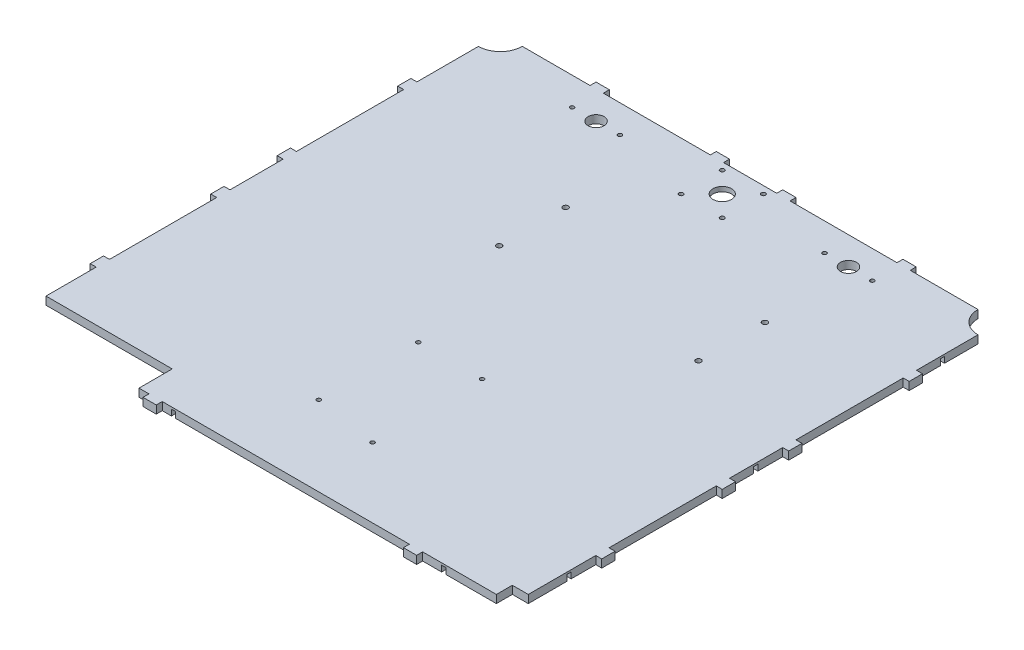
from build123d import *

# Parameters (mm, degrees)
SALIENTE_EXTRUIR1_DEPTH = 6
CORTAR_EXTRUIR1_DEPTH   = 4.5
CROQUIS5_R              = 7
CROQUIS5_R_2            = 1.6
CROQUIS5_R_3            = 6
CROQUIS5_R_4            = 1.5
CROQUIS5_W              = 12
CROQUIS5_H              = 12
CORTAR_EXTRUIR2_DEPTH   = 6
CROQUIS7_R              = 2
CROQUIS7_R_2            = 1.5
CROQUIS7_W              = 95
CROQUIS7_H              = 25
CORTAR_EXTRUIR4_DEPTH   = 10
CORTAR_EXTRUIR5_START   = -2.5
CROQUIS8_R              = 11
CROQUIS8_R_2            = 7
CROQUIS8_R_3            = 4.5
CROQUIS8_R_4            = 1.5
CORTAR_EXTRUIR5_DEPTH   = 2.5


with BuildPart() as part:
    # Croquis1 → Saliente-Extruir1 (new body)
    with BuildSketch(Plane(origin=(0, 0, 0), x_dir=(1, 0, 0), z_dir=(0, 1, 0))):
        with BuildLine():
            Line((0, 0), (67.5, 0))
            Line((67.5, 0), (77.5, 0))
            Line((77.5, 0), (102.5, 0))
            Line((102.5, 0), (102.5, -4.5))
            Line((102.5, -4.5), (112.5, -4.5))
            Line((112.5, -4.5), (112.5, 0))
            Line((112.5, 0), (298.5, 0))
            Line((298.5, 0), (298.5, -4.5))
            Line((298.5, -4.5), (308.5, -4.5))
            Line((308.5, -4.5), (308.5, 0))
            Line((308.5, 0), (376, 0))
            Line((376, 0), (376, 62.8))
            Line((376, 62.8), (380.5, 62.8))
            Line((380.5, 62.8), (380.5, 72.8))
            Line((380.5, 72.8), (376, 72.8))
            Line((376, 72.8), (376, 153.5))
            Line((376, 153.5), (380.5, 153.5))
            Line((380.5, 153.5), (380.5, 163.5))
            Line((380.5, 163.5), (376, 163.5))
            Line((376, 163.5), (376, 203.5))
            Line((376, 203.5), (380.5, 203.5))
            Line((380.5, 203.5), (380.5, 213.5))
            Line((380.5, 213.5), (376, 213.5))
            Line((376, 213.5), (376, 294.2))
            Line((376, 294.2), (380.5, 294.2))
            Line((380.5, 294.2), (380.5, 304.2))
            Line((380.5, 304.2), (376, 304.2))
            Line((376, 304.2), (376, 350.5))
            ThreePointArc((376, 350.5), (364.33273811, 355.33273811), (359.5, 367))
            Line((359.5, 367), (308.5, 367))
            Line((308.5, 367), (308.5, 371.5))
            Line((308.5, 371.5), (298.5, 371.5))
            Line((298.5, 371.5), (298.5, 367))
            Line((298.5, 367), (218, 367))
            Line((218, 367), (218, 371.5))
            Line((218, 371.5), (208, 371.5))
            Line((208, 371.5), (208, 367))
            Line((208, 367), (168, 367))
            Line((168, 367), (168, 371.5))
            Line((168, 371.5), (158, 371.5))
            Line((158, 371.5), (158, 367))
            Line((158, 367), (77.5, 367))
            Line((77.5, 367), (77.5, 371.5))
            Line((77.5, 371.5), (67.5, 371.5))
            Line((67.5, 371.5), (67.5, 367))
            Line((67.5, 367), (16.5, 367))
            ThreePointArc((16.5, 367), (11.66726189, 355.33273811), (0, 350.5))
            Line((0, 350.5), (0, 304.2))
            Line((0, 304.2), (-4.5, 304.2))
            Line((-4.5, 304.2), (-4.5, 294.2))
            Line((-4.5, 294.2), (0, 294.2))
            Line((0, 294.2), (0, 213.5))
            Line((0, 213.5), (-4.5, 213.5))
            Line((-4.5, 213.5), (-4.5, 203.5))
            Line((-4.5, 203.5), (0, 203.5))
            Line((0, 203.5), (0, 163.5))
            Line((0, 163.5), (-4.5, 163.5))
            Line((-4.5, 163.5), (-4.5, 153.5))
            Line((-4.5, 153.5), (0, 153.5))
            Line((0, 153.5), (0, 72.8))
            Line((0, 72.8), (-4.5, 72.8))
            Line((-4.5, 72.8), (-4.5, 62.8))
            Line((-4.5, 62.8), (0, 62.8))
            Line((0, 62.8), (0, 0))
        make_face()
    extrude(amount=-SALIENTE_EXTRUIR1_DEPTH)

    # Croquis3 → Cortar-Extruir1 (cut)
    with BuildSketch(Plane.XZ.offset(6)):
        with BuildLine():
            Line((325.901879925, -6.500225242), (325.901879925, 0))
            Line((325.901879925, 0), (322.801879925, 0))
            Line((322.801879925, 0), (322.801879925, -6.500225243))
            ThreePointArc((322.801879925, -6.500225243), (321.87727529, -7.028314779), (321.511542294, -8.028320611))
            Line((321.511542294, -8.028320611), (321.511542294, -9.578320611))
            ThreePointArc((321.511542294, -9.578320611), (321.700239124, -10.319504582), (322.220385751, -10.880225243))
            Line((322.220385751, -10.880225243), (322.389630684, -10.880225243))
            ThreePointArc((322.389630684, -10.880225243), (324.351879925, -11.693235227), (326.314129166, -10.880225242))
            Line((326.314129166, -10.880225242), (326.483374099, -10.880225243))
            ThreePointArc((326.483374099, -10.880225243), (327.003520726, -10.319504582), (327.192217556, -9.578320611))
            Line((327.192217556, -9.578320611), (327.192217556, -8.028320611))
            ThreePointArc((327.192217556, -8.028320611), (326.82648456, -7.028314779), (325.901879925, -6.500225242))
        make_face()
        with BuildLine():
            Line((322.801879925, -360.499774758), (322.801879925, -367))
            Line((322.801879925, -367), (325.901879925, -367))
            Line((325.901879925, -367), (325.901879925, -360.499774758))
            ThreePointArc((325.901879925, -360.499774758), (326.82648456, -359.971685221), (327.192217556, -358.971679389))
            Line((327.192217556, -358.971679389), (327.192217556, -357.421679389))
            ThreePointArc((327.192217556, -357.421679389), (327.003520726, -356.680495418), (326.483374099, -356.119774758))
            Line((326.483374099, -356.119774758), (326.314129166, -356.119774758))
            ThreePointArc((326.314129166, -356.119774758), (324.351879925, -355.306764773), (322.389630684, -356.119774757))
            Line((322.389630684, -356.119774757), (322.220385751, -356.119774757))
            ThreePointArc((322.220385751, -356.119774757), (321.700239124, -356.680495418), (321.511542294, -357.421679389))
            Line((321.511542294, -357.421679389), (321.511542294, -358.971679389))
            ThreePointArc((321.511542294, -358.971679389), (321.87727529, -359.971685221), (322.801879925, -360.499774758))
        make_face()
        with BuildLine():
            Line((8.028320611, -326.749605009), (9.578320611, -326.749605009))
            ThreePointArc((9.578320611, -326.749605009), (10.319504582, -326.560908179), (10.880225243, -326.040761552))
            Line((10.880225243, -326.040761552), (10.880225243, -325.87151662))
            ThreePointArc((10.880225243, -325.87151662), (11.693235227, -323.909267378), (10.880225243, -321.947018137))
            Line((10.880225243, -321.947018137), (10.880225243, -321.777773205))
            ThreePointArc((10.880225243, -321.777773205), (10.319504582, -321.257626577), (9.578320611, -321.068929747))
            Line((9.578320611, -321.068929747), (8.028320611, -321.068929747))
            ThreePointArc((8.028320611, -321.068929747), (7.028314779, -321.434662744), (6.500225243, -322.359267378))
            Line((6.500225243, -322.359267378), (0, -322.359267378))
            Line((0, -322.359267378), (0, -325.459267378))
            Line((0, -325.459267378), (6.500225243, -325.459267378))
            ThreePointArc((6.500225243, -325.459267378), (7.028314779, -326.383872013), (8.028320611, -326.749605009))
        make_face()
        with BuildLine():
            Line((6.500225242, -41.36), (0, -41.36))
            Line((0, -41.36), (0, -44.46))
            Line((0, -44.46), (6.500225243, -44.46))
            ThreePointArc((6.500225243, -44.46), (7.028314779, -45.384604635), (8.028320611, -45.750337631))
            Line((8.028320611, -45.750337631), (9.578320611, -45.750337631))
            ThreePointArc((9.578320611, -45.750337631), (10.319504582, -45.561640801), (10.880225243, -45.041494174))
            Line((10.880225243, -45.041494174), (10.880225243, -44.872249241))
            ThreePointArc((10.880225243, -44.872249241), (11.693235227, -42.91), (10.880225243, -40.947750759))
            Line((10.880225243, -40.947750759), (10.880225243, -40.778505826))
            ThreePointArc((10.880225243, -40.778505826), (10.319504582, -40.258359199), (9.578320611, -40.069662369))
            Line((9.578320611, -40.069662369), (8.028320611, -40.069662369))
            ThreePointArc((8.028320611, -40.069662369), (7.028314779, -40.435395365), (6.500225242, -41.36))
        make_face()
        with BuildLine():
            Line((8.028320611, -186.245954203), (9.578320611, -186.245954203))
            ThreePointArc((9.578320611, -186.245954203), (10.319504582, -186.057257373), (10.880225243, -185.537110746))
            Line((10.880225243, -185.537110746), (10.880225243, -185.367865814))
            ThreePointArc((10.880225243, -185.367865814), (11.693235227, -183.405616572), (10.880225243, -181.443367331))
            Line((10.880225243, -181.443367331), (10.880225243, -181.274122399))
            ThreePointArc((10.880225243, -181.274122399), (10.319504582, -180.753975771), (9.578320611, -180.565278941))
            Line((9.578320611, -180.565278941), (8.028320611, -180.565278941))
            ThreePointArc((8.028320611, -180.565278941), (7.028314779, -180.931011938), (6.500225243, -181.855616572))
            Line((6.500225243, -181.855616572), (0, -181.855616572))
            Line((0, -181.855616572), (0, -184.955616572))
            Line((0, -184.955616572), (6.500225243, -184.955616572))
            ThreePointArc((6.500225243, -184.955616572), (7.028314779, -185.880221207), (8.028320611, -186.245954203))
        make_face()
        with BuildLine():
            Line((122.550656557, -6.500225243), (122.550656557, 0))
            Line((122.550656557, 0), (119.450656557, 0))
            Line((119.450656557, 0), (119.450656557, -6.500225243))
            ThreePointArc((119.450656557, -6.500225243), (118.526051922, -7.028314779), (118.160318926, -8.028320611))
            Line((118.160318926, -8.028320611), (118.160318926, -9.578320611))
            ThreePointArc((118.160318926, -9.578320611), (118.349015756, -10.319504582), (118.869162383, -10.880225243))
            Line((118.869162383, -10.880225243), (119.038407316, -10.880225243))
            ThreePointArc((119.038407316, -10.880225243), (121.000656557, -11.693235227), (122.962905798, -10.880225243))
            Line((122.962905798, -10.880225243), (123.132150731, -10.880225243))
            ThreePointArc((123.132150731, -10.880225243), (123.652297358, -10.319504582), (123.840994188, -9.578320611))
            Line((123.840994188, -9.578320611), (123.840994188, -8.028320611))
            ThreePointArc((123.840994188, -8.028320611), (123.475261191, -7.028314779), (122.550656557, -6.500225243))
        make_face()
        with BuildLine():
            Line((369.499774757, -44.286426511), (376, -44.286426511))
            Line((376, -44.286426511), (376, -41.186426511))
            Line((376, -41.186426511), (369.499774757, -41.186426511))
            ThreePointArc((369.499774757, -41.186426511), (368.971685221, -40.261821877), (367.971679389, -39.89608888))
            Line((367.971679389, -39.89608888), (366.421679389, -39.89608888))
            ThreePointArc((366.421679389, -39.89608888), (365.680495418, -40.08478571), (365.119774757, -40.604932337))
            Line((365.119774757, -40.604932337), (365.119774757, -40.77417727))
            ThreePointArc((365.119774757, -40.77417727), (364.306764773, -42.736426511), (365.119774757, -44.698675752))
            Line((365.119774757, -44.698675752), (365.119774757, -44.867920685))
            ThreePointArc((365.119774757, -44.867920685), (365.680495418, -45.388067312), (366.421679389, -45.576764142))
            Line((366.421679389, -45.576764142), (367.971679389, -45.576764142))
            ThreePointArc((367.971679389, -45.576764142), (368.971685221, -45.211031146), (369.499774757, -44.286426511))
        make_face()
        with BuildLine():
            Line((367.971679389, -180.400754709), (366.421679389, -180.400754709))
            ThreePointArc((366.421679389, -180.400754709), (365.680495418, -180.589451539), (365.119774757, -181.109598166))
            Line((365.119774757, -181.109598166), (365.119774757, -181.278843099))
            ThreePointArc((365.119774757, -181.278843099), (364.306764773, -183.24109234), (365.119774757, -185.203341581))
            Line((365.119774757, -185.203341581), (365.119774757, -185.372586514))
            ThreePointArc((365.119774757, -185.372586514), (365.680495418, -185.892733141), (366.421679389, -186.081429971))
            Line((366.421679389, -186.081429971), (367.971679389, -186.081429971))
            ThreePointArc((367.971679389, -186.081429971), (368.971685221, -185.715696975), (369.499774757, -184.79109234))
            Line((369.499774757, -184.79109234), (376, -184.79109234))
            Line((376, -184.79109234), (376, -181.69109234))
            Line((376, -181.69109234), (369.499774757, -181.69109234))
            ThreePointArc((369.499774757, -181.69109234), (368.971685221, -180.766487705), (367.971679389, -180.400754709))
        make_face()
        with BuildLine():
            Line((369.499774757, -325.277950066), (376, -325.277950066))
            Line((376, -325.277950066), (376, -322.177950066))
            Line((376, -322.177950066), (369.499774757, -322.177950066))
            ThreePointArc((369.499774757, -322.177950066), (368.971685221, -321.253345432), (367.971679389, -320.887612435))
            Line((367.971679389, -320.887612435), (366.421679389, -320.887612435))
            ThreePointArc((366.421679389, -320.887612435), (365.680495418, -321.076309265), (365.119774757, -321.596455893))
            Line((365.119774757, -321.596455893), (365.119774757, -321.765700825))
            ThreePointArc((365.119774757, -321.765700825), (364.306764773, -323.727950066), (365.119774757, -325.690199308))
            Line((365.119774757, -325.690199308), (365.119774757, -325.85944424))
            ThreePointArc((365.119774757, -325.85944424), (365.680495418, -326.379590867), (366.421679389, -326.568287697))
            Line((366.421679389, -326.568287697), (367.971679389, -326.568287697))
            ThreePointArc((367.971679389, -326.568287697), (368.971685221, -326.202554701), (369.499774757, -325.277950066))
        make_face()
        with BuildLine():
            Line((50.098120075, -360.499774758), (50.098120075, -367))
            Line((50.098120075, -367), (53.198120075, -367))
            Line((53.198120075, -367), (53.198120075, -360.499774758))
            ThreePointArc((53.198120075, -360.499774758), (54.12272471, -359.971685221), (54.488457706, -358.971679389))
            Line((54.488457706, -358.971679389), (54.488457706, -357.421679389))
            ThreePointArc((54.488457706, -357.421679389), (54.299760876, -356.680495418), (53.779614249, -356.119774758))
            Line((53.779614249, -356.119774758), (53.610369316, -356.119774758))
            ThreePointArc((53.610369316, -356.119774758), (51.648120075, -355.306764773), (49.685870834, -356.119774757))
            Line((49.685870834, -356.119774757), (49.516625901, -356.119774757))
            ThreePointArc((49.516625901, -356.119774757), (48.996479274, -356.680495418), (48.807782444, -357.421679389))
            Line((48.807782444, -357.421679389), (48.807782444, -358.971679389))
            ThreePointArc((48.807782444, -358.971679389), (49.17351544, -359.971685221), (50.098120075, -360.499774758))
        make_face()
    extrude(amount=-CORTAR_EXTRUIR1_DEPTH, mode=Mode.SUBTRACT)

    # Croquis5 → Cortar-Extruir2 (cut)
    with BuildSketch(Plane(origin=(0, 0, 0), x_dir=(1, 0, 0), z_dir=(0, 1, 0))):
        with Locations(Location((188, 346, 0), (0, 0, 270))):
            Circle(CROQUIS5_R)
        with Locations(Location((172.5, 361.5, 0), (0, 0, 270))):
            Circle(CROQUIS5_R_2)
        with Locations(Location((203.5, 361.5, 0), (0, 0, 270))):
            Circle(CROQUIS5_R_2)
        with Locations(Location((203.5, 330.5, 0), (0, 0, 270))):
            Circle(CROQUIS5_R_2)
        with Locations(Location((172.5, 330.5, 0), (0, 0, 270))):
            Circle(CROQUIS5_R_2)
        with Locations(Location((93, 346, 0), (0, 0, 270))):
            Circle(CROQUIS5_R_3)
        with Locations(Location((111, 346, 0), (0, 0, 270))):
            Circle(CROQUIS5_R_4)
        with Locations(Location((75, 346, 0), (0, 0, 270))):
            Circle(CROQUIS5_R_4)
        with Locations(Location((301, 346, 0), (0, 0, 270))):
            Circle(CROQUIS5_R_4)
        with Locations(Location((265, 346, 0), (0, 0, 270))):
            Circle(CROQUIS5_R_4)
        with Locations(Location((283, 346, 0), (0, 0, 270))):
            Circle(CROQUIS5_R_3)
        with Locations((6, 6)):
            Rectangle(CROQUIS5_W, CROQUIS5_H)
        with Locations((370, 6)):
            Rectangle(CROQUIS5_W, CROQUIS5_H)
    extrude(amount=-CORTAR_EXTRUIR2_DEPTH, mode=Mode.SUBTRACT)

    # Croquis7 → Cortar-Extruir4 (cut)
    with BuildSketch(Plane(origin=(0, 0, 0), x_dir=(1, 0, 0), z_dir=(0, 1, 0))):
        with Locations(Location((137.744149305, 278.350339736, 0), (0, 0, 270))):
            Circle(CROQUIS7_R)
        with Locations(Location((137.744149305, 228.350339736, 0), (0, 0, 270))):
            Circle(CROQUIS7_R)
        with Locations(Location((287.744149305, 228.350339736, 0), (0, 0, 270))):
            Circle(CROQUIS7_R)
        with Locations(Location((287.744149305, 278.350339736, 0), (0, 0, 270))):
            Circle(CROQUIS7_R)
        with Locations(Location((218.27359351, 134.989356687, 0), (0, 0, 270))):
            Circle(CROQUIS7_R_2)
        with Locations(Location((170.27359351, 134.989356687, 0), (0, 0, 270))):
            Circle(CROQUIS7_R_2)
        with Locations(Location((218.27359351, 52.489356687, 0), (0, 0, 270))):
            Circle(CROQUIS7_R_2)
        with Locations(Location((170.27359351, 59.989356687, 0), (0, 0, 270))):
            Circle(CROQUIS7_R_2)
        with Locations((47.5, 12.5)):
            Rectangle(CROQUIS7_W, CROQUIS7_H)
    extrude(amount=-CORTAR_EXTRUIR4_DEPTH, mode=Mode.SUBTRACT)

    # Croquis8 → Cortar-Extruir5 (cut)
    # profile 1 of 5: a face of its own
    with BuildSketch(Plane.XZ.offset(6).offset(CORTAR_EXTRUIR5_START)):
        with Locations(Location((188, -346, 0), (0, 0, 270))):
            Circle(CROQUIS8_R)
        with Locations(Location((188, -346, 0), (0, 0, 90))):
            Circle(CROQUIS8_R_2, mode=Mode.SUBTRACT)
    # profile 2 of 5: a face of its own
    with BuildSketch(Plane.XZ.offset(6).offset(CORTAR_EXTRUIR5_START)):
        with Locations(Location((111, -346, 0), (0, 0, 270))):
            Circle(CROQUIS8_R_3)
    # profile 3 of 5: a face of its own
    with BuildSketch(Plane.XZ.offset(6).offset(CORTAR_EXTRUIR5_START)):
        with Locations(Location((75, -346, 0), (0, 0, 270))):
            Circle(CROQUIS8_R_3)
    # profile 4 of 5: a face of its own
    with BuildSketch(Plane.XZ.offset(6).offset(CORTAR_EXTRUIR5_START)):
        with Locations(Location((265, -346, 0), (0, 0, 270))):
            Circle(CROQUIS8_R_3)
        with Locations(Location((265, -346, 0), (0, 0, 270))):
            Circle(CROQUIS8_R_4, mode=Mode.SUBTRACT)
    # profile 5 of 5: a face of its own
    with BuildSketch(Plane.XZ.offset(6).offset(CORTAR_EXTRUIR5_START)):
        with Locations(Location((301, -346, 0), (0, 0, 270))):
            Circle(CROQUIS8_R_3)
    extrude(amount=CORTAR_EXTRUIR5_DEPTH, mode=Mode.SUBTRACT)


solid = part.part
